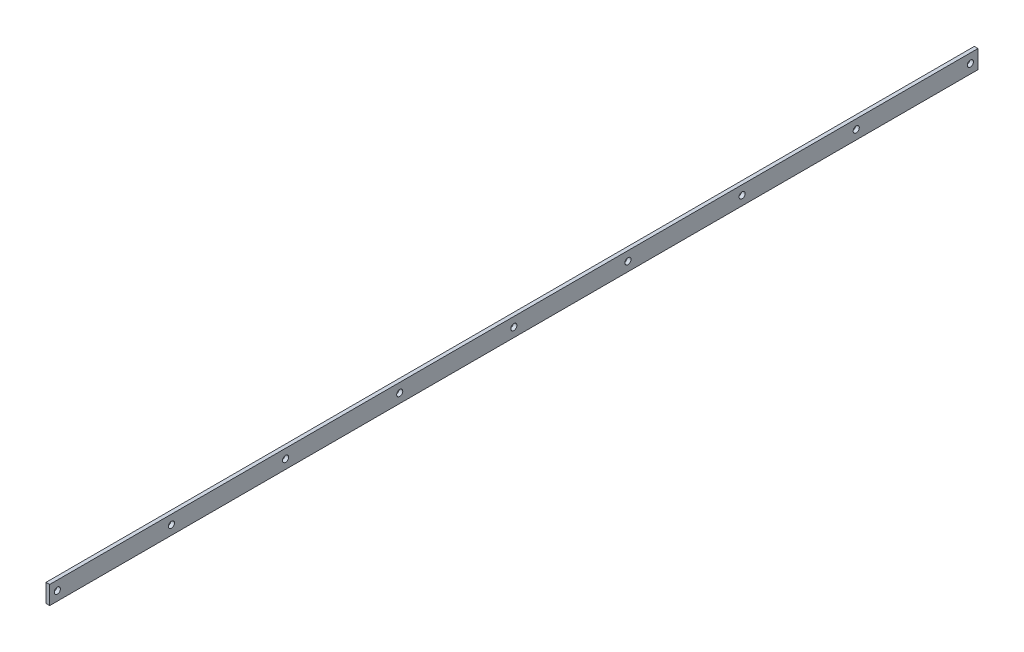
from build123d import *

# Parameters (mm, degrees)
SKETCH1_W           = 3034
SKETCH1_H           = 60
BOSS_EXTRUDE1_DEPTH = 12
SKETCH2_R           = 10
CUT_EXTRUDE1_DEPTH  = 12
LPATTERN1_COUNT     = 9
LPATTERN1_PITCH     = 373


with BuildPart() as part:
    # Sketch1 → Boss-Extrude1 (new body)
    with BuildSketch(Plane(origin=(0, 0, 0), x_dir=(0, 0, -1), z_dir=(1, 0, 0))):
        Rectangle(SKETCH1_W, SKETCH1_H)
    extrude(amount=BOSS_EXTRUDE1_DEPTH)

    # Sketch2 → Cut-Extrude1 (cut)
    with BuildSketch(Plane(origin=(12, 0, 0), x_dir=(0, 0, -1), z_dir=(1, 0, 0))):
        with Locations((-1492, 0)):
            Circle(SKETCH2_R)
    cut_extrude1 = extrude(amount=-CUT_EXTRUDE1_DEPTH, mode=Mode.SUBTRACT)

    # LPattern1: Cut-Extrude1 ×9
    with Locations(*[(0, 0, -i * LPATTERN1_PITCH) for i in range(1, LPATTERN1_COUNT)]):
        add(cut_extrude1, mode=Mode.SUBTRACT)


solid = part.part
